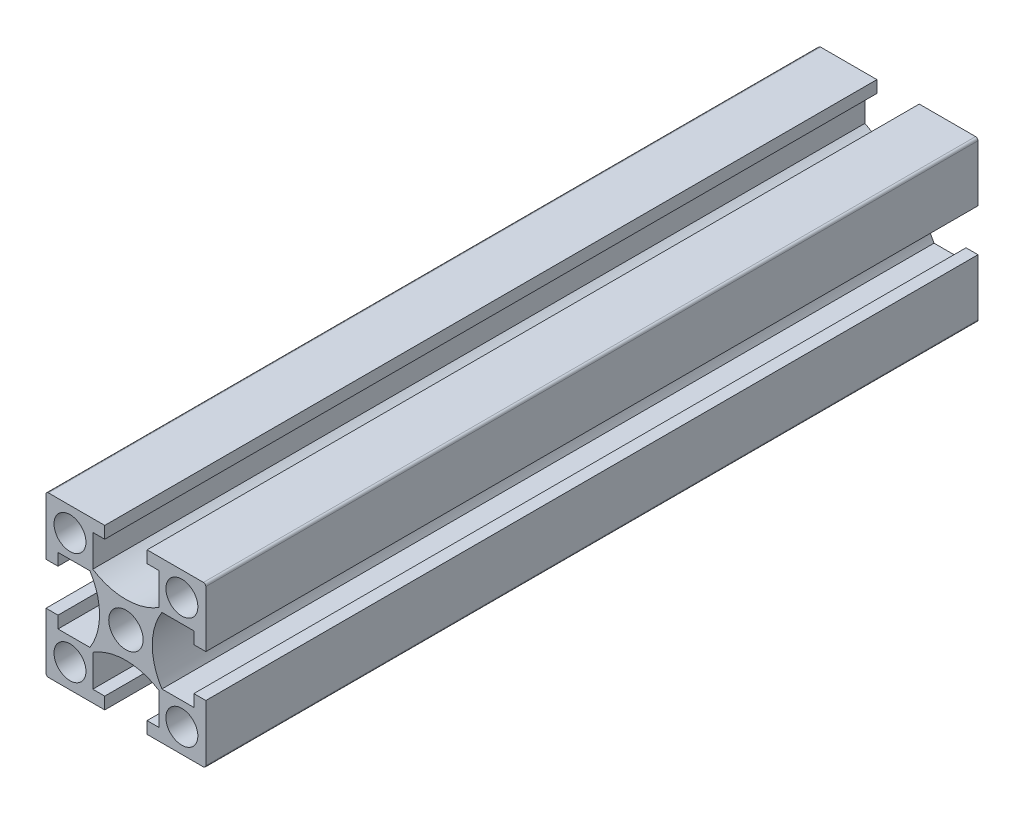
from build123d import *

# Parameters (mm, degrees)
SKETCH_1_W               = 20
SKETCH_1_H               = 20
SKETCH_1_R               = 2
SKETCH_1_R_2             = 2.15
EXTRUDE_1_DEPTH          = 293
CUT_EXTRUDE_1_REACH      = 295.341
PATTERN_CIRCULAR_1_COUNT = 4
FILLET_1_R               = 0.3
CUT_EXTRUDE_2_DEPTH      = 294.341098382
CUT_EXTRUDE_2_DEPTH_BACK = 294.341098382
SKETCH_2_R               = 2.5
SKETCH_4_R               = 2.5
CUT_EXTRUDE_3_DEPTH      = 294.852003666
SKETCH_6_R               = 2.15
SKETCH_6_R_2             = 1.97965
CUT_EXTRUDE_4_DEPTH      = 294.852003666
SKETCH_7_W               = 20
SKETCH_7_H               = 196.38
CUT_EXTRUDE_5_DEPTH      = 294.852003666


with BuildPart() as part:
    # 스케치1 → 보스-돌출1 (new body)
    with BuildSketch(Plane.XY):
        Rectangle(SKETCH_1_W, SKETCH_1_H)
        with Locations((-7, -7)):
            Circle(SKETCH_1_R, mode=Mode.SUBTRACT)
        with Locations((7, -7)):
            Circle(SKETCH_1_R, mode=Mode.SUBTRACT)
        with Locations((-7, 7)):
            Circle(SKETCH_1_R, mode=Mode.SUBTRACT)
        Circle(SKETCH_1_R_2, mode=Mode.SUBTRACT)
        with Locations((7, 7)):
            Circle(SKETCH_1_R, mode=Mode.SUBTRACT)
    extrude(amount=EXTRUDE_1_DEPTH)

    # 스케치1<3> → 컷-돌출1 (cut, up to next)
    with BuildSketch(Plane.XY, mode=Mode.PRIVATE) as cut_extrude_1_sk1:
        with BuildLine():
            Line((-8.5, 2.65), (-10, 2.65))
            Line((-10, 2.65), (-10, -2.65))
            Line((-10, -2.65), (-8.5, -2.65))
            Line((-8.5, -2.65), (-8.5, -4.15))
            Line((-8.5, -4.15), (-4.503166667, -4.15))
            ThreePointArc((-4.503166667, -4.15), (-3.3, 0), (-4.503166667, 4.15))
            Line((-4.503166667, 4.15), (-8.5, 4.15))
            Line((-8.5, 4.15), (-8.5, 2.65))
        make_face()
    cut_extrude_1_tool1 = extrude(cut_extrude_1_sk1.sketch, amount=CUT_EXTRUDE_1_REACH, mode=Mode.PRIVATE) & part.part
    cut_extrude_1 = cut_extrude_1_tool1.solids().sort_by_distance((-6.606913, 0, 0))[0]
    add(cut_extrude_1, mode=Mode.SUBTRACT)

    # 원형 패턴1: 컷-돌출1 ×4 about axis
    pattern_circular_1_axis = Axis((0, 0, 293), (0, 0, -1))
    for i in range(1, PATTERN_CIRCULAR_1_COUNT):
        add(cut_extrude_1.rotate(pattern_circular_1_axis, i * 360 / PATTERN_CIRCULAR_1_COUNT), mode=Mode.SUBTRACT)

    # 필렛1
    fillet_1_edges = [part.edges().sort_by_distance(p)[0] for p in [
        (10, -10, 146.5),
        (-10, -10, 146.5),
        (-10, 10, 146.5),
        (10, 10, 146.5),
    ]]
    fillet(fillet_1_edges, radius=FILLET_1_R)

    # 스케치2 → 컷-돌출2 (cut, two sides: drawn at the far end of the back side and taken through both)
    with BuildSketch(Plane(origin=(0, 0, 0), x_dir=(0, 0, -1), z_dir=(1, 0, 0)).offset(-CUT_EXTRUDE_2_DEPTH_BACK)):
        with Locations((-25, 0)):
            Circle(SKETCH_2_R)
    extrude(amount=CUT_EXTRUDE_2_DEPTH + CUT_EXTRUDE_2_DEPTH_BACK, mode=Mode.SUBTRACT)

    # 스케치4 → 컷-돌출3 (cut, through all)
    with BuildSketch(Plane(origin=(0, 10, 0), x_dir=(1, 0, 0), z_dir=(0, 1, 0))):
        with Locations((0, -282)):
            Circle(SKETCH_4_R)
        with Locations((0, -127.62)):
            Circle(SKETCH_4_R)
        with Locations((0, -85.62)):
            Circle(SKETCH_4_R)
    extrude(amount=-CUT_EXTRUDE_3_DEPTH, mode=Mode.SUBTRACT)

    # 스케치6 → 컷-돌출4 (cut, through all)
    with BuildSketch(Plane(origin=(0, 10, 0), x_dir=(1, 0, 0), z_dir=(0, 1, 0))):
        with Locations((0, -236.9)):
            Circle(SKETCH_6_R)
        with Locations((0, -184.9)):
            Circle(SKETCH_6_R)
        with Locations((0, -10.15)):
            Circle(SKETCH_6_R_2)
        with Locations((0, -62.15)):
            Circle(SKETCH_6_R)
    extrude(amount=-CUT_EXTRUDE_4_DEPTH, mode=Mode.SUBTRACT)

    # 스케치7 → 컷-돌출5 (cut, through all)
    with BuildSketch(Plane(origin=(0, 10, 0), x_dir=(1, 0, 0), z_dir=(0, 1, 0))):
        with Locations((0, -194.81)):
            Rectangle(SKETCH_7_W, SKETCH_7_H)
    extrude(amount=-CUT_EXTRUDE_5_DEPTH, mode=Mode.SUBTRACT)


solid = part.part
